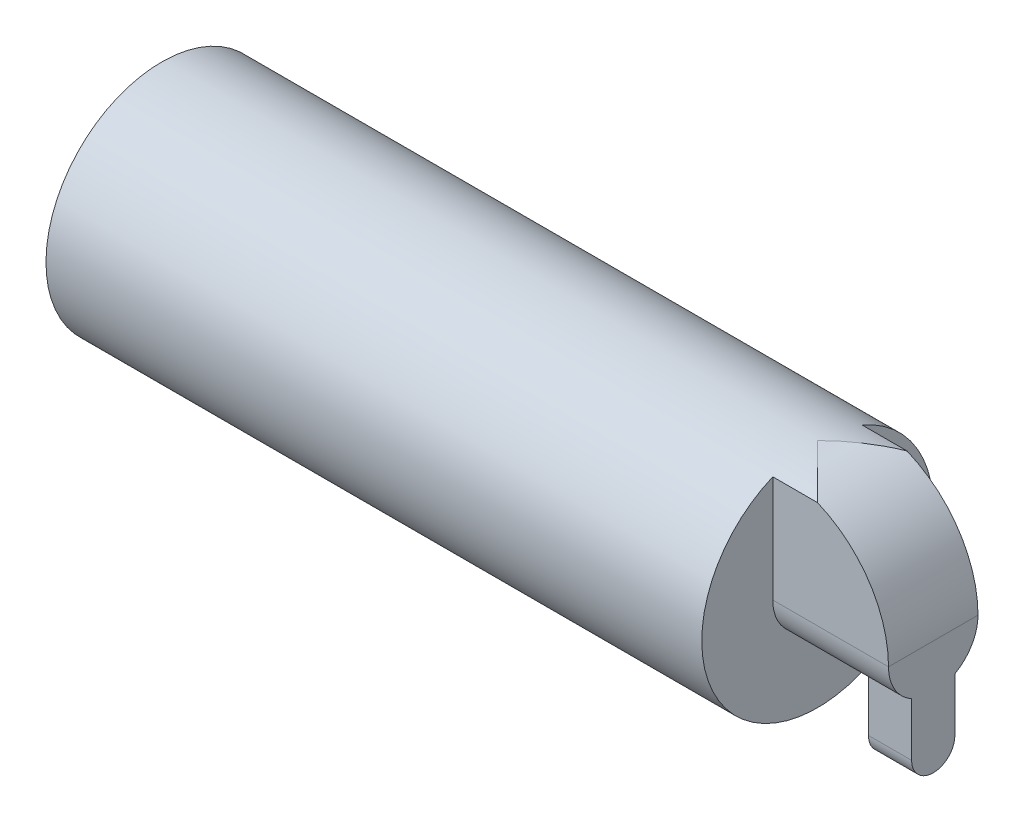
from build123d import *

# Parameters (mm, degrees)
SKETCH1_R               = 7.5
BOSS_EXTRUDE1_DEPTH     = 42.5
BOSS_EXTRUDE2_DEPTH     = 50
BOSS_EXTRUDE3_DEPTH     = 2.8
CUT_EXTRUDE1_DEPTH      = 7.5
CUT_EXTRUDE1_DEPTH_BACK = 7.5
CUT_EXTRUDE2_DEPTH      = 8


with BuildPart() as part:
    # Sketch1 → Boss-Extrude1 (new body)
    with BuildSketch(Plane(origin=(0, 0, 0), x_dir=(0, 0, -1), z_dir=(1, 0, 0))):
        Circle(SKETCH1_R)
    extrude(amount=BOSS_EXTRUDE1_DEPTH)

    # Sketch3 → Boss-Extrude2 (add)
    with BuildSketch(Plane(origin=(0, 0, 0), x_dir=(0, 0, -1), z_dir=(1, 0, 0))):
        with BuildLine():
            Line((-2.9, 0), (-2.9, 6.916646586))
            ThreePointArc((-2.9, 6.916646586), (0, 7.5), (2.9, 6.916646586))
            Line((2.9, 6.916646586), (2.9, 0))
            ThreePointArc((2.9, 0), (0, -2.9), (-2.9, 0))
        make_face()
    extrude(amount=BOSS_EXTRUDE2_DEPTH)

    # Sketch4 → Boss-Extrude3 (add)
    with BuildSketch(Plane(origin=(50, 0, 0), x_dir=(0, 0, -1), z_dir=(1, 0, 0))):
        with BuildLine():
            Line((-1.4, -6), (-1.4, 0))
            Line((-1.4, 0), (1.4, 0))
            Line((1.4, 0), (1.4, -6))
            ThreePointArc((1.4, -6), (0, -7.4), (-1.4, -6))
        make_face()
    extrude(amount=-BOSS_EXTRUDE3_DEPTH)

    # Sketch6 → Cut-Extrude1 (cut, two sides: drawn at the far end of the back side and taken through both)
    with BuildSketch(Plane.XY.offset(-CUT_EXTRUDE1_DEPTH_BACK)):
        with BuildLine():
            Line((50, 0), (50, 7.5))
            Line((50, 7.5), (42.5, 7.5))
            ThreePointArc((42.5, 7.5), (47.803300859, 5.303300859), (50, 0))
        make_face()
        with BuildLine():
            Line((-50, 7.5), (-42.5, 7.5))
            ThreePointArc((-42.5, 7.5), (-47.803300859, 5.303300859), (-50, 0))
            Line((-50, 0), (-50, 7.5))
        make_face()
    extrude(amount=CUT_EXTRUDE1_DEPTH + CUT_EXTRUDE1_DEPTH_BACK, mode=Mode.SUBTRACT)

    # Sketch7 → Cut-Extrude2 (cut)
    with BuildSketch(Plane.ZY):
        Polygon((-4, 0), (-2.828427125, 1.171572875), (-2.828427125, 2.828427125), (-1.171572875, 2.828427125), (0, 4), (1.171572875, 2.828427125), (2.828427125, 2.828427125), (2.828427125, 1.171572875), (4, 0), (2.828427125, -1.171572875), (2.828427125, -2.828427125), (1.171572875, -2.828427125), (0, -4), (-1.171572875, -2.828427125), (-2.828427125, -2.828427125), (-2.828427125, -1.171572875), align=None)
    extrude(amount=-CUT_EXTRUDE2_DEPTH, mode=Mode.SUBTRACT)


solid = part.part
